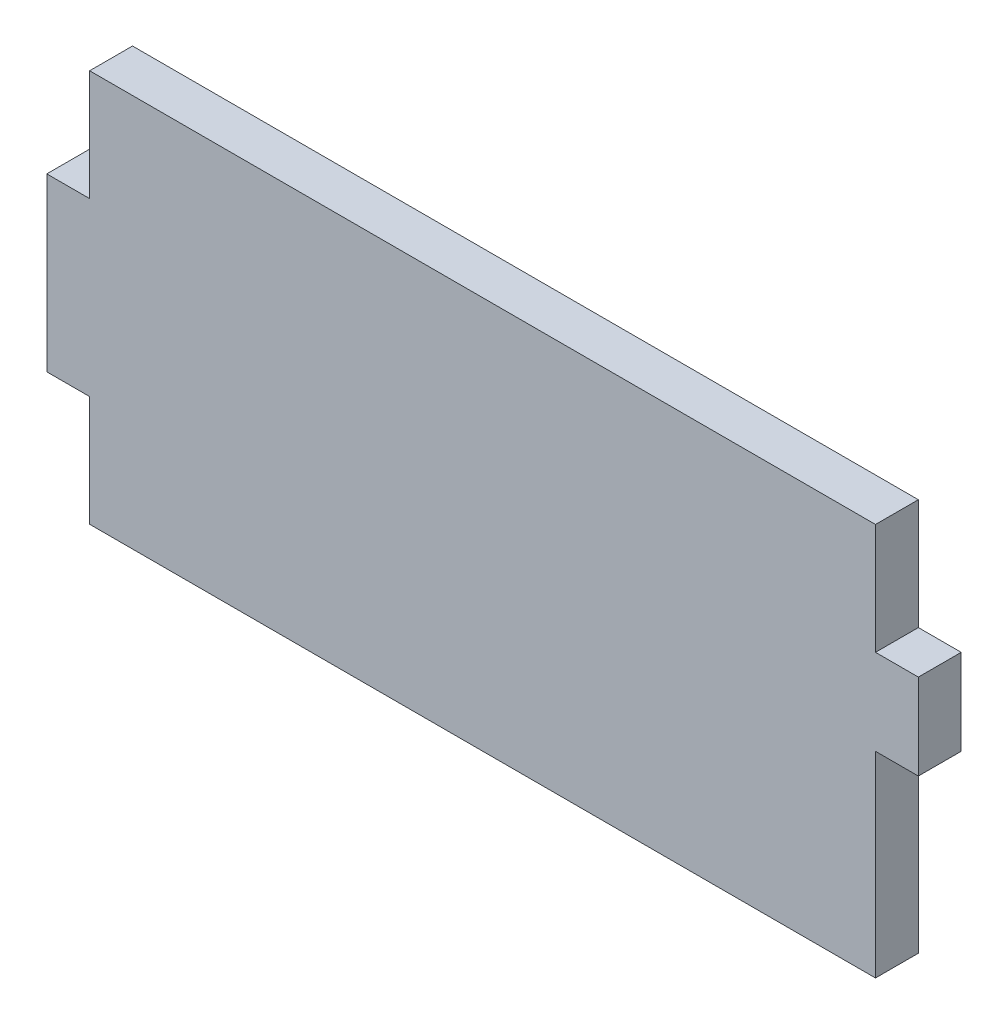
from build123d import *

# Parameters (mm, degrees)
P_IDAT_VYSUNUT_M1_DEPTH = 3


with BuildPart() as part:
    # Skica1 → Přidat vysunutím1 (new body)
    with BuildSketch(Plane.XY):
        Polygon((55, -13.75), (55, -27.49), (0, -27.49), (0, -19.75), (-3, -19.75), (-3, -7.75), (0, -7.75), (0, 0), (55, 0), (55, -7.75), (58, -7.75), (58, -13.75), align=None)
    extrude(amount=P_IDAT_VYSUNUT_M1_DEPTH)


solid = part.part
